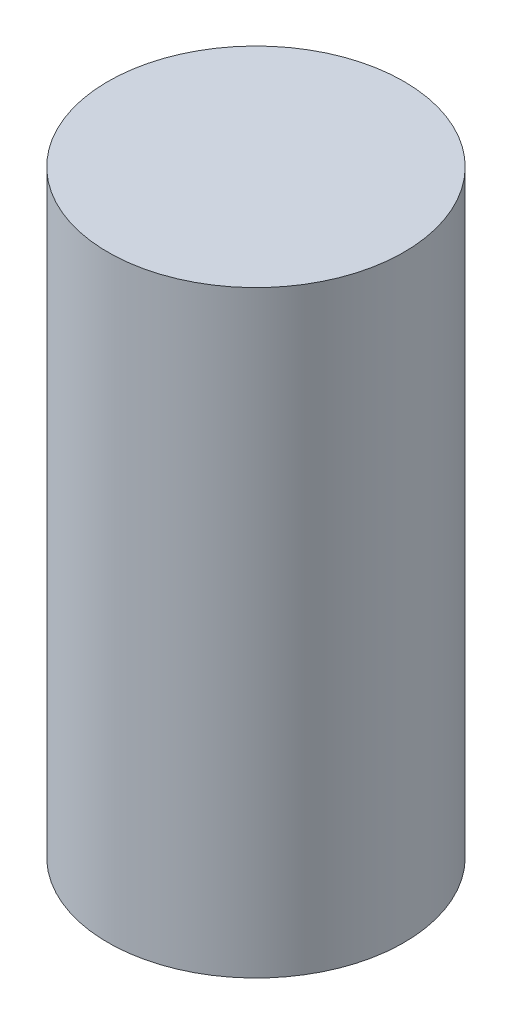
from build123d import *

# Parameters (mm, degrees)
ESBO_O1_R                = 2.45
RESSALTO_EXTRUS_O1_DEPTH = 4.95


with BuildPart() as part:
    # Esboço1 → Ressalto-extrusão1 (new, symmetric)
    with BuildSketch(Plane(origin=(0, 0, 0), x_dir=(1, 0, 0), z_dir=(0, 1, 0))):
        with Locations(Location((0, 0, 0), (0, 0, 90))):
            Circle(ESBO_O1_R)
    extrude(amount=RESSALTO_EXTRUS_O1_DEPTH, both=True)


solid = part.part
